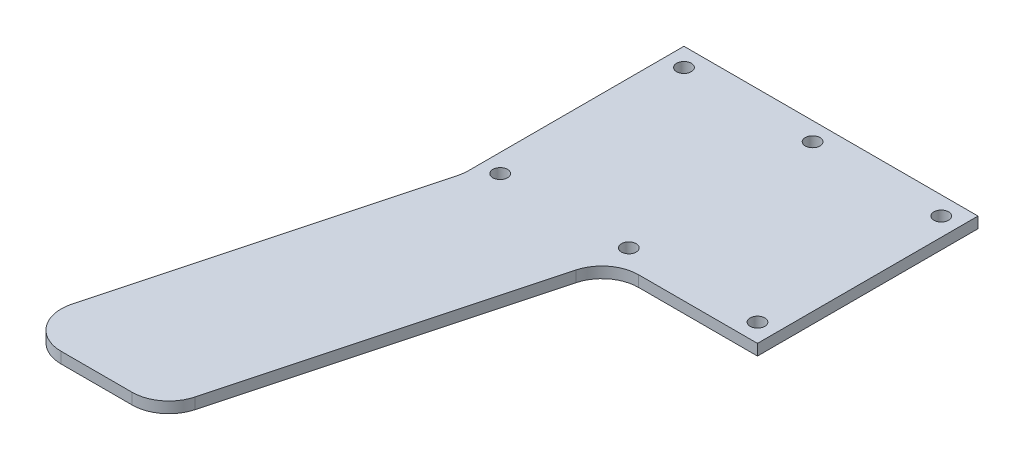
from build123d import *

# Parameters (mm, degrees)
SKETCH1_W           = 80
SKETCH1_H           = 60
SKETCH1_R           = 2
BOSS_EXTRUDE1_DEPTH = 3
FILLET1_R           = 10


with BuildPart() as part:
    # Sketch1 → Boss-Extrude1 (new body)
    # profile 1 of 2: a face of its own
    with BuildSketch(Plane(origin=(0, 0, 0), x_dir=(1, 0, 0), z_dir=(0, 1, 0))):
        with Locations((40, 30)):
            Rectangle(SKETCH1_W, SKETCH1_H)
        with Locations(Location((40, 5, 0), (0, 0, 270))):
            Circle(SKETCH1_R, mode=Mode.SUBTRACT)
        with Locations(Location((40, 55, 0), (0, 0, 270))):
            Circle(SKETCH1_R, mode=Mode.SUBTRACT)
        with Locations(Location((5, 5, 0), (0, 0, 270))):
            Circle(SKETCH1_R, mode=Mode.SUBTRACT)
        with Locations(Location((75, 5, 0), (0, 0, 270))):
            Circle(SKETCH1_R, mode=Mode.SUBTRACT)
        with Locations(Location((75, 55, 0), (0, 0, 270))):
            Circle(SKETCH1_R, mode=Mode.SUBTRACT)
        with Locations(Location((5, 55, 0), (0, 0, 270))):
            Circle(SKETCH1_R, mode=Mode.SUBTRACT)
    # profile 2 of 2: a face of its own
    with BuildSketch(Plane(origin=(0, 0, 0), x_dir=(1, 0, 0), z_dir=(0, 1, 0))):
        Polygon((14.11809549, -96.592582629), (40, 0), (0, 0), (-25.88190451, -96.592582629), align=None)
    extrude(amount=BOSS_EXTRUDE1_DEPTH)

    # Fillet1
    fillet1_edges = [part.edges().sort_by_distance(p)[0] for p in [
        (40, 1.5, 0),
        (14.11809549, 1.5, 96.592582629),
        (-25.88190451, 1.5, 96.592582629),
        (0, 1.5, 0),
    ]]
    fillet(fillet1_edges, radius=FILLET1_R)


solid = part.part
